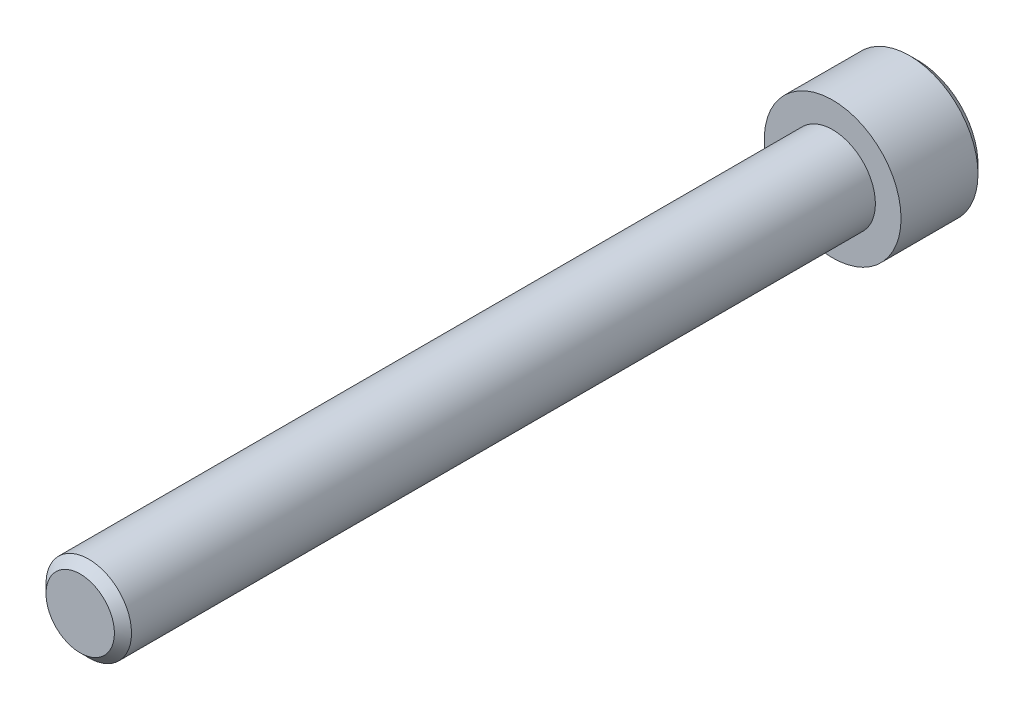
from build123d import *

# Parameters (mm, degrees)
SKETCH_1_W          = 8
SKETCH_1_H          = 10
SKETCH_2_R          = 5
EXTRUDE_1_DEPTH     = 88
CUT_EXTRUDE_1_DEPTH = 7
CHAMFER_1_SIZE2     = 1.000000001
CHAMFER_1_SIZE      = 0.999999999


with BuildPart() as part:
    # 草图1 → 旋转1 (revolve)
    with BuildSketch(Plane(origin=(0, 0, 0), x_dir=(1, 0, 0), z_dir=(0, 1, 0))):
        with Locations((4, -5)):
            Rectangle(SKETCH_1_W, SKETCH_1_H)
    revolve(axis=Axis((0, 0, 0), (0, 0, 1)))

    # 草图2 → 凸台-拉伸1 (add)
    with BuildSketch(Plane.XY.offset(10)):
        Circle(SKETCH_2_R)
    extrude(amount=EXTRUDE_1_DEPTH)

    # 草图3 → 切除-拉伸1 (cut)
    with BuildSketch(Plane(origin=(0, 0, 0), x_dir=(-1, 0, 0), z_dir=(0, 0, -1))):
        Polygon((-2.309401077, 4), (-4.618802154, 0), (-2.309401077, -4), (2.309401077, -4), (4.618802154, 0), (2.309401077, 4), align=None)
    extrude(amount=-CUT_EXTRUDE_1_DEPTH, mode=Mode.SUBTRACT)

    # 倒角1
    chamfer_1_edges = [part.edges().sort_by_distance(p)[0] for p in [
        (-5, 0, 98),
        (-8, 0, 0),
    ]]
    chamfer(chamfer_1_edges, length=CHAMFER_1_SIZE, length2=CHAMFER_1_SIZE2)


solid = part.part
